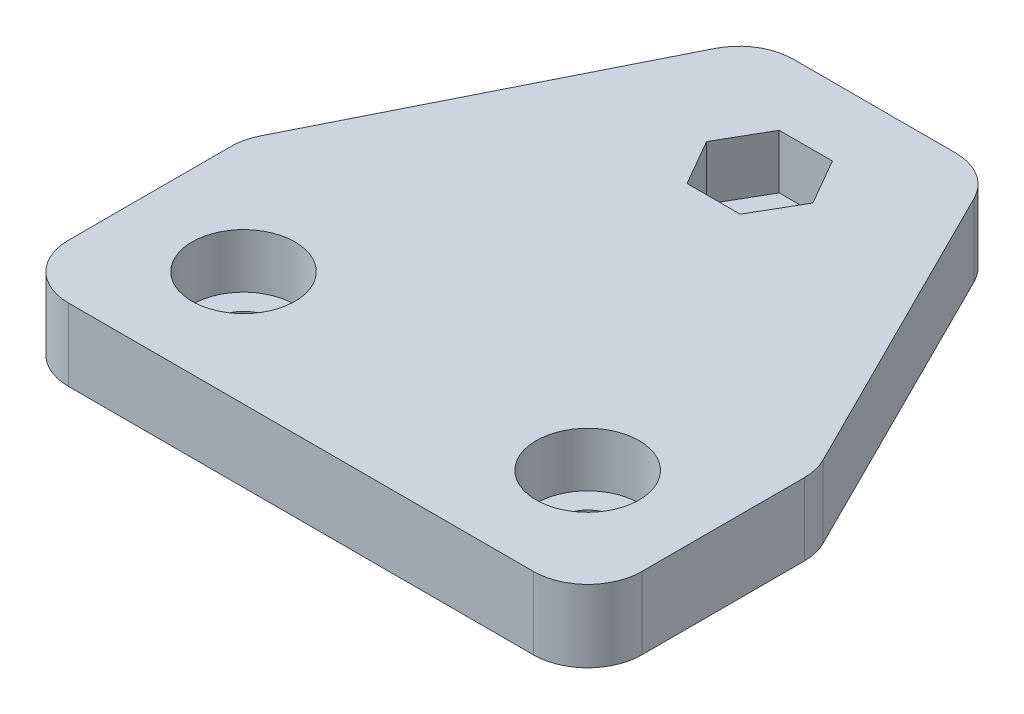
from build123d import *

# Parameters (mm, degrees)
BOSS_EXTRUDE1_DEPTH     = 8
CUT_EXTRUDE1_DEPTH      = 72.444471445
CUT_EXTRUDE1_DEPTH_BACK = 72.444471445
SKETCH2_R               = 3.1
FILLET1_R               = 6
CUT_EXTRUDE2_DEPTH      = 72.444471445
CUT_EXTRUDE2_DEPTH_BACK = 6
SKETCH3_R               = 5.7


with BuildPart() as part:
    # Sketch1 → Boss-Extrude1 (new body)
    with BuildSketch(Plane(origin=(0, 0, 0), x_dir=(1, 0, 0), z_dir=(0, 1, 0))):
        Polygon((-31.75, 0), (31.75, 0), (31.75, 25.4), (12.7, 63.5), (-12.7, 63.5), (-31.75, 25.4), align=None)
    extrude(amount=BOSS_EXTRUDE1_DEPTH)

    # Sketch2 → Cut-Extrude1 (cut, two sides: drawn at the far end of the back side and taken through both)
    with BuildSketch(Plane(origin=(0, 8, 0), x_dir=(1, 0, 0), z_dir=(0, 1, 0)).offset(-CUT_EXTRUDE1_DEPTH_BACK)):
        with Locations(Location((0, 50.8, 0), (0, 0, 270))):
            Circle(SKETCH2_R)
        with Locations(Location((-19.05, 12.7, 0), (0, 0, 270))):
            Circle(SKETCH2_R)
        with Locations(Location((19.05, 12.7, 0), (0, 0, 270))):
            Circle(SKETCH2_R)
    extrude(amount=CUT_EXTRUDE1_DEPTH + CUT_EXTRUDE1_DEPTH_BACK, mode=Mode.SUBTRACT)

    # Fillet1
    fillet1_edges = [part.edges().sort_by_distance(p)[0] for p in [
        (31.75, 4, 0),
        (-31.75, 4, 0),
        (-31.75, 4, -25.4),
        (-12.7, 4, -63.5),
        (12.7, 4, -63.5),
        (31.75, 4, -25.4),
    ]]
    fillet(fillet1_edges, radius=FILLET1_R)

    # Sketch3 → Cut-Extrude2 (cut, two sides: drawn at the far end of the back side and taken through both)
    with BuildSketch(Plane(origin=(0, 8, 0), x_dir=(1, 0, 0), z_dir=(0, 1, 0)).offset(-CUT_EXTRUDE2_DEPTH_BACK)):
        with Locations(Location((-19.05, 12.7, 0), (0, 0, 90))):
            Circle(SKETCH3_R)
        with Locations(Location((19.05, 12.7, 0), (0, 0, 90))):
            Circle(SKETCH3_R)
        Polygon((5.888972746, 50.8), (2.944486373, 55.9), (-2.944486373, 55.9), (-5.888972746, 50.8), (-2.944486373, 45.7), (2.944486373, 45.7), align=None)
    extrude(amount=CUT_EXTRUDE2_DEPTH + CUT_EXTRUDE2_DEPTH_BACK, mode=Mode.SUBTRACT)


solid = part.part
